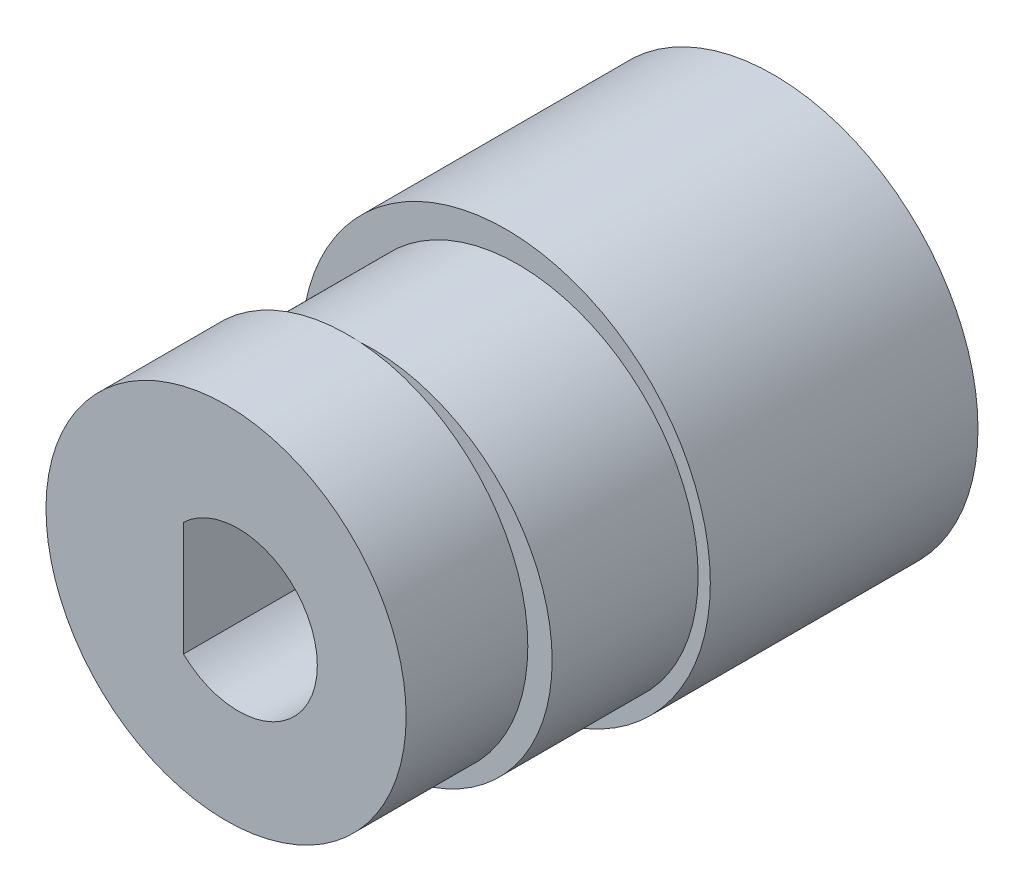
from build123d import *

# Parameters (mm, degrees)
ESQUISSE1_R             = 8.4
BOSS_EXTRU_1_DEPTH      = 11
ESQUISSE3_R             = 7.4
BOSS_EXTRU_2_DEPTH      = 6
ESQUISSE4_R             = 7.4
BOSS_EXTRU_3_DEPTH      = 5
ENL_V_MAT_EXTRU_1_DEPTH = 26.002399885


with BuildPart() as part:
    # Esquisse1 → Boss.-Extru.1 (new body)
    with BuildSketch(Plane.XY):
        Circle(ESQUISSE1_R)
    extrude(amount=BOSS_EXTRU_1_DEPTH)

    # Esquisse3 → Boss.-Extru.2 (add)
    with BuildSketch(Plane.XY.offset(11)):
        with Locations((0.5, 0)):
            Circle(ESQUISSE3_R)
    extrude(amount=BOSS_EXTRU_2_DEPTH)

    # Esquisse4 → Boss.-Extru.3 (add)
    with BuildSketch(Plane.XY.offset(17)):
        with Locations(Location((-0.5, 0, 0), (0, 0, 273.874288206))):
            Circle(ESQUISSE4_R)
    extrude(amount=BOSS_EXTRU_3_DEPTH)

    # Esquisse5 → Enlèv. mat.-Extru.1 (cut, through all)
    with BuildSketch(Plane(origin=(0, 0, 0), x_dir=(-1, 0, 0), z_dir=(0, 0, -1))):
        with BuildLine():
            Line((2.25, 2.34520788), (2.25, -2.34520788))
            ThreePointArc((2.25, -2.34520788), (-3.25, 0), (2.25, 2.34520788))
        make_face()
    extrude(amount=-ENL_V_MAT_EXTRU_1_DEPTH, mode=Mode.SUBTRACT)


solid = part.part
